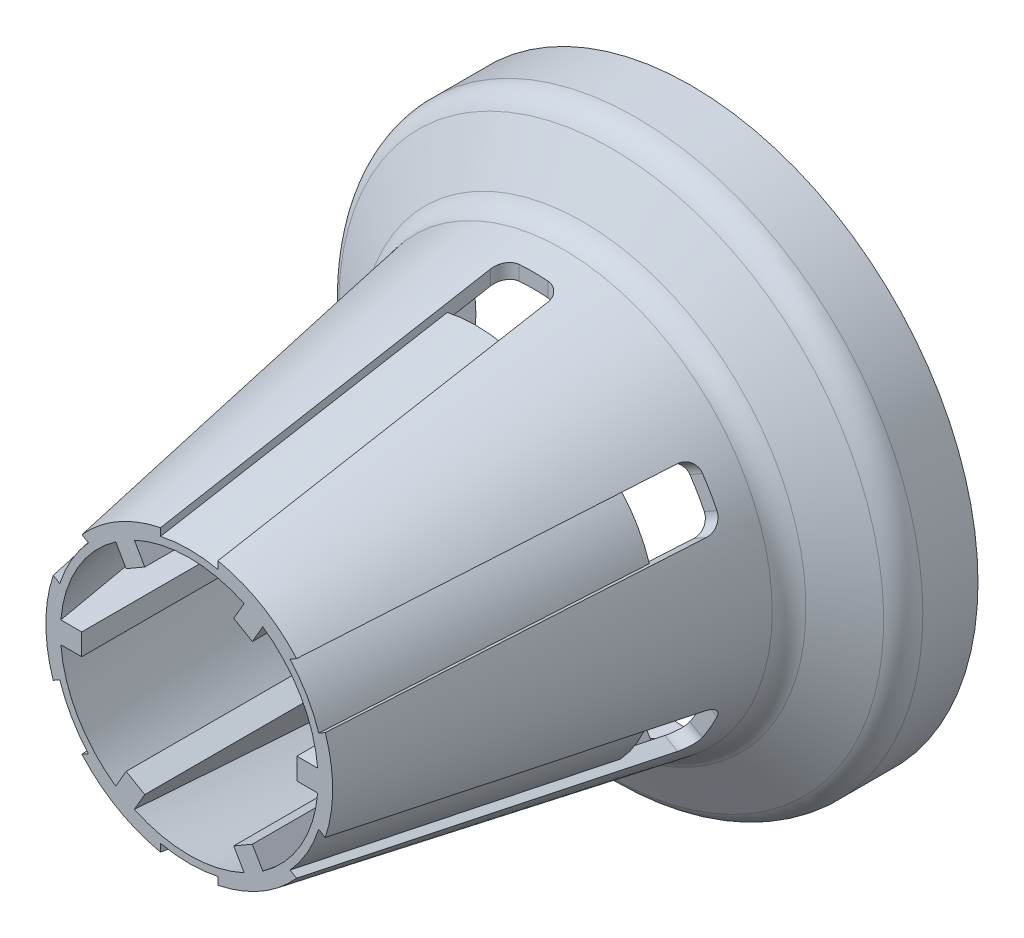
from build123d import *

# Parameters (mm, degrees)
SKORUPA1_T                      = -2
WYTNIJ_WYCI_GNI_CIE1_REACH      = 77.498
SZYK_KO_OWY1_COUNT              = 6
ZAOKR_GLENIE1_R                 = 10
SZYK_KO_OWY2_COUNT              = 6
ZAOKR_GLENIE1_OF_SZYK_KO_OWY2_R = 10


with BuildPart() as part:
    # Szkic1 → Obrót1 (revolve)
    with BuildSketch(Plane(origin=(0, 0, 0), x_dir=(0, 0, -1), z_dir=(1, 0, 0)), mode=Mode.PRIVATE) as obr_t1_sk:
        with BuildLine():
            Line((-50, 0), (20, 0))
            Line((20, 0), (20, 40))
            Line((20, 40), (12.309401077, 40))
            ThreePointArc((12.309401077, 40), (10.309401077, 39.464101615), (8.845299462, 38))
            Line((8.845299462, 38), (4.87731103, 31.127242432))
            ThreePointArc((4.87731103, 31.127242432), (3.70751516, 29.850634255), (2.107802125, 29.18801142))
            Line((2.107802125, 29.18801142), (-50, 20))
            Line((-50, 20), (-50, 0))
        make_face()
    revolve(obr_t1_sk.sketch.rotate(Axis((0, 0, 50), (0, 0, -1)), 180), axis=Axis((0, 0, 50), (0, 0, -1)))

    # Skorupa1
    skorupa1_openings = [part.faces().sort_by_distance(p)[0] for p in [
        (0, 0, -20),
        (0, 0, 50),
    ]]
    offset(amount=SKORUPA1_T, openings=skorupa1_openings, kind=Kind.INTERSECTION)

    # Wycięcie-wyciągnięcie po ścieżce1: sweep along a path in Szkic3
    with BuildLine(Plane(origin=(0, 0, 0), x_dir=(0, 0, -1), z_dir=(1, 0, 0))) as wyci_cie_wyci_gni_cie_po_cie_ce1_path:
        Line((-50, 18.969146776), (-10, 26.022226005))
    # Szkic2 → Wycięcie-wyciągnięcie po ścieżce1 (sweep, cut)
    with BuildSketch(Plane.XY.offset(50)):
        with BuildLine():
            Line((-4, 18.542613878), (-4, 24.542613878))
            Line((-4, 24.542613878), (4, 24.542613878))
            Line((4, 24.542613878), (4, 18.542613878))
            ThreePointArc((4, 18.542613878), (0, 18.969146776), (-4, 18.542613878))
        make_face()
    wyci_cie_wyci_gni_cie_po_cie_ce1 = sweep(path=wyci_cie_wyci_gni_cie_po_cie_ce1_path.line, mode=Mode.SUBTRACT)

    # Wytnij-wyciągnięcie1: up to this cone (the profile starts inside it)
    wytnij_wyci_gni_cie1_end = Plane(origin=(0, 0, 6.097945), z_dir=(0, 0, -1)) * Cone(9.096457596, 46.385776014, 211.47823361, mode=Mode.PRIVATE)
    # Szkic4 → Wytnij-wyciągnięcie1 (cut, up to the surface)
    with BuildSketch(Plane(origin=(0, 0, 0), x_dir=(1, 0, 0), z_dir=(0, 1, 0)), mode=Mode.PRIVATE) as wytnij_wyci_gni_cie1_sk1:
        with BuildLine():
            Line((-2, -2), (2, -2))
            ThreePointArc((2, -2), (3.414213562, -2.585786438), (4, -4))
            Line((4, -4), (4, -10))
            Line((4, -10), (-4, -10))
            Line((-4, -10), (-4, -4))
            ThreePointArc((-4, -4), (-3.414213562, -2.585786438), (-2, -2))
        make_face()
    wytnij_wyci_gni_cie1_tool1 = extrude(wytnij_wyci_gni_cie1_sk1.sketch, amount=WYTNIJ_WYCI_GNI_CIE1_REACH, mode=Mode.PRIVATE) & wytnij_wyci_gni_cie1_end
    wytnij_wyci_gni_cie1 = wytnij_wyci_gni_cie1_tool1.solids().sort_by_distance((0, 0, 6.097945))[0]
    add(wytnij_wyci_gni_cie1, mode=Mode.SUBTRACT)

    # Szyk kołowy1: Wycięcie-wyciągnięcie po ścieżce1, Wytnij-wyciągnięcie1 ×6 about axis
    szyk_ko_owy1_axis = Axis((0, 0, 50), (0, 0, -1))
    add([wyci_cie_wyci_gni_cie_po_cie_ce1.rotate(szyk_ko_owy1_axis, i * 360 / SZYK_KO_OWY1_COUNT) for i in range(1, SZYK_KO_OWY1_COUNT)], mode=Mode.SUBTRACT)
    add([wytnij_wyci_gni_cie1.rotate(szyk_ko_owy1_axis, i * 360 / SZYK_KO_OWY1_COUNT) for i in range(1, SZYK_KO_OWY1_COUNT)], mode=Mode.SUBTRACT)

    # Szkic5 for Wyci_gni_cie → Wyciągnięcie po profilach1 section 0
    with BuildSketch(Plane.XY.offset(50)):
        with BuildLine():
            Line((-10.252253113, -14.757423284), (-8.799038106, -12.240381057))
            Line((-8.799038106, -12.240381057), (-6.200961894, -13.740381057))
            Line((-6.200961894, -13.740381057), (-7.654176902, -16.257423284))
            # circular arc as an exact rational Bezier (weights 1, cos(half-angle), 1)
            Bezier((-7.654176902, -16.257423284), (-9.016041601, -15.616242136), (-10.252253113, -14.757423284), weights=[1, 0.996509753, 1])
        make_face()
    # Szkic6 for Wyci_gni_cie → Wyciągnięcie po profilach1 section 1
    with BuildSketch(Plane.XY):
        with BuildLine():
            Line((-8.799038106, -12.240381057), (-6.200961894, -13.740381057))
            Line((-6.200961894, -13.740381057), (-12.289477966, -24.286000236))
            Bezier((-12.289477966, -24.286000236), (-13.62991132, -23.607698909), (-14.887554177, -22.786000236), weights=[1, 0.998480301, 1])
            Line((-14.887554177, -22.786000236), (-8.799038106, -12.240381057))
        make_face()
    wyci_gni_cie_po_profilach1 = loft()

    # Zaokrąglenie1
    zaokr_glenie1_edges = [part.edges().sort_by_distance(p)[0] for p in [
        (-7.5, -12.990381057, 0),
    ]]
    fillet(zaokr_glenie1_edges, radius=ZAOKR_GLENIE1_R)

    # Szyk kołowy2: Wyciągnięcie po profilach1 ×6 about axis
    szyk_ko_owy2_axis = Axis((0, 0, 0), (0, 0, 1))
    for i in range(1, SZYK_KO_OWY2_COUNT):
        add(wyci_gni_cie_po_profilach1.rotate(szyk_ko_owy2_axis, i * 360 / SZYK_KO_OWY2_COUNT))

    # Zaokrąglenie1 of Szyk kołowy2
    zaokr_glenie1_of_szyk_ko_owy2_edges = [part.edges().sort_by_distance(p)[0] for p in [
        (7.5, -12.990381057, 0),
        (15, 0, 0),
        (7.5, 12.990381057, 0),
        (-7.5, 12.990381057, 0),
        (-15, 0, 0),
    ]]
    fillet(zaokr_glenie1_of_szyk_ko_owy2_edges, radius=ZAOKR_GLENIE1_OF_SZYK_KO_OWY2_R)


solid = part.part
